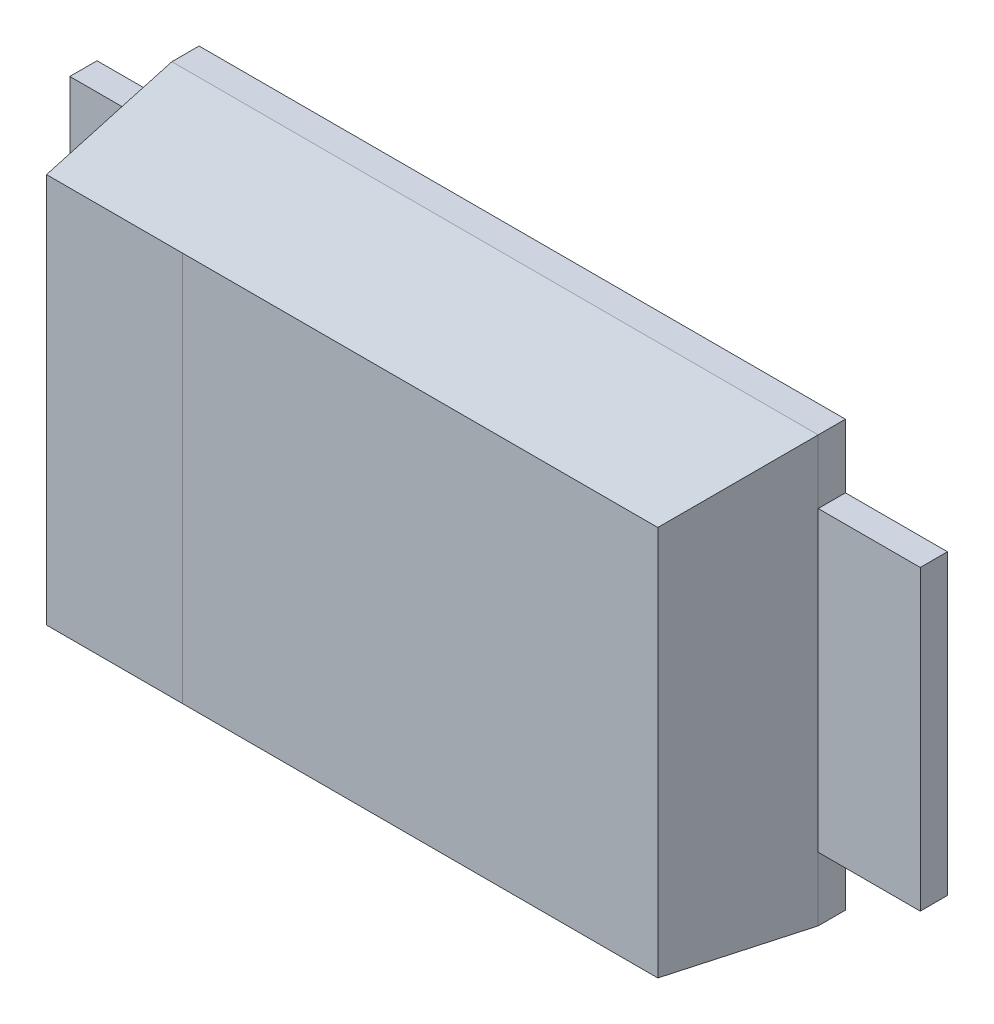
from build123d import *

# Parameters (mm, degrees)
ESQUISSE1_W     = 3.8
ESQUISSE1_H     = 2.5
CASE_BASE_DEPTH = 0.16
ESQUISSE2_W     = 3.8
ESQUISSE2_H     = 2.5
CASE_TOP_DEPTH  = 0.84
CASE_TOP_TAPER  = 7
ESQUISSE3_W     = 5
ESQUISSE3_H     = 1.75
PINS_DEPTH      = 0.16


with BuildPart() as part:
    # Esquisse1 → case base (new body)
    with BuildSketch(Plane.XY):
        Rectangle(ESQUISSE1_W, ESQUISSE1_H)
    extrude(amount=CASE_BASE_DEPTH)

    # Esquisse2 → case top (add)
    with BuildSketch(Plane.XY.offset(0.16)):
        Rectangle(ESQUISSE2_W, ESQUISSE2_H)
    extrude(amount=CASE_TOP_DEPTH, taper=CASE_TOP_TAPER)

    # Esquisse3 → pins (add)
    with BuildSketch(Plane.XY):
        Rectangle(ESQUISSE3_W, ESQUISSE3_H)
    extrude(amount=PINS_DEPTH)


solid = part.part
